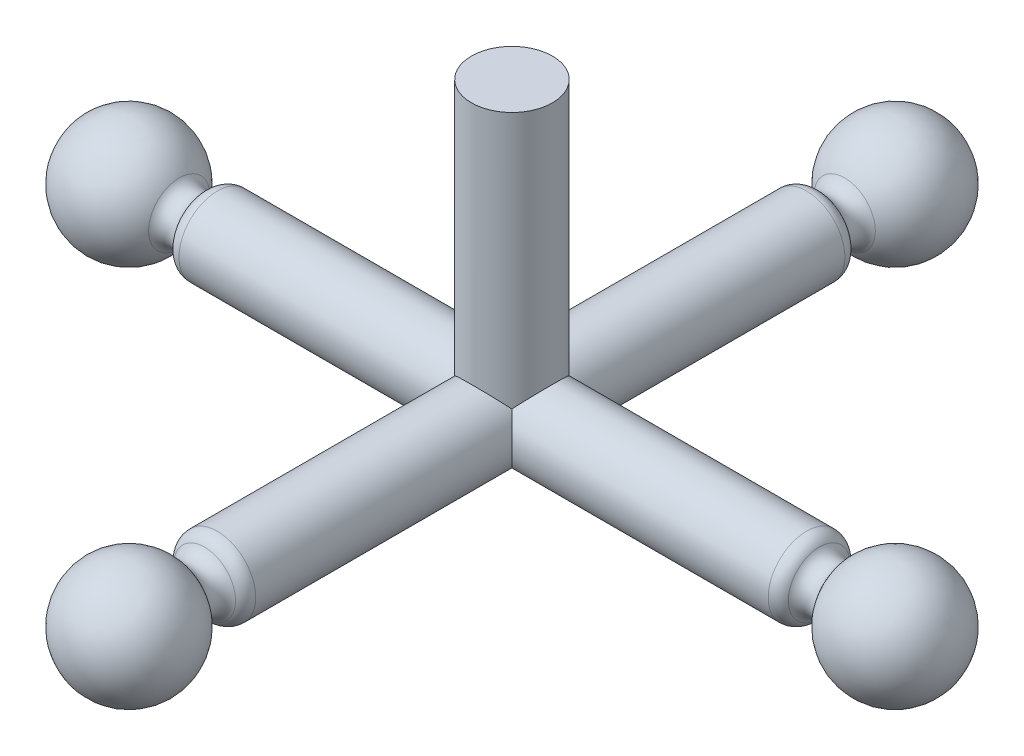
from build123d import *

# Parameters (mm, degrees)
SKETCH3_W = 2.75
SKETCH3_H = 19.162808803


with BuildPart() as part:
    # Sketch1 → Revolve1 (revolve)
    with BuildSketch(Plane.XY, mode=Mode.PRIVATE) as revolve1_sk:
        with BuildLine():
            Line((30, 0), (-30, 0))
            ThreePointArc((-30, 0), (-27.082257498, 3.85080754), (-22.585640646, 2.083782667))
            ThreePointArc((-22.585640646, 2.083782667), (-21.719871273, 1.604802507), (-20.866025404, 2.104728333))
            ThreePointArc((-20.866025404, 2.104728333), (-20.5, 2.470753737), (-20, 2.604728333))
            Line((-20, 2.604728333), (20, 2.604728333))
            ThreePointArc((20, 2.604728333), (20.5, 2.470753737), (20.866025404, 2.104728333))
            ThreePointArc((20.866025404, 2.104728333), (21.719871273, 1.604802507), (22.585640646, 2.083782667))
            ThreePointArc((22.585640646, 2.083782667), (27.082257498, 3.85080754), (30, 0))
        make_face()
    revolve(revolve1_sk.sketch.rotate(Axis((30, 0, 0), (-1, 0, 0)), 90), axis=Axis((30, 0, 0), (-1, 0, 0)))

    # Sketch2 → Revolve4 (revolve)
    with BuildSketch(Plane(origin=(0, 0, 0), x_dir=(0, 0, -1), z_dir=(1, 0, 0))):
        with BuildLine():
            Line((0, 0), (-30, 0))
            ThreePointArc((-30, 0), (-27.080124955, 3.851406247), (-22.583334959, 2.08))
            ThreePointArc((-22.583334959, 2.08), (-21.717542874, 1.600067582), (-20.863143295, 2.1))
            ThreePointArc((-20.863143295, 2.1), (-20.497117892, 2.466025404), (-19.997117892, 2.6))
            Line((-19.997117892, 2.6), (0.002882108, 2.6))
            Line((0.002882108, 2.6), (20.002882108, 2.6))
            ThreePointArc((20.002882108, 2.6), (20.501668422, 2.466724993), (20.867503236, 2.102424427))
            ThreePointArc((20.867503236, 2.102424427), (21.721331497, 1.6049071), (22.585699491, 2.083879084))
            ThreePointArc((22.585699491, 2.083879084), (27.082311869, 3.850792258), (30, 0))
            Line((30, 0), (0, 0))
        make_face()
    revolve(axis=Axis((0, 0, 0), (0, 0, 1)))

    # Sketch3 → Revolve5 (revolve)
    with BuildSketch(Plane.XY, mode=Mode.PRIVATE) as revolve5_sk:
        with Locations((-1.375, 9.581404402)):
            Rectangle(SKETCH3_W, SKETCH3_H)
    revolve(revolve5_sk.sketch.rotate(Axis((0, 19.162808803, 0), (0, -1, 0)), 270), axis=Axis((0, 19.162808803, 0), (0, -1, 0)))


solid = part.part
